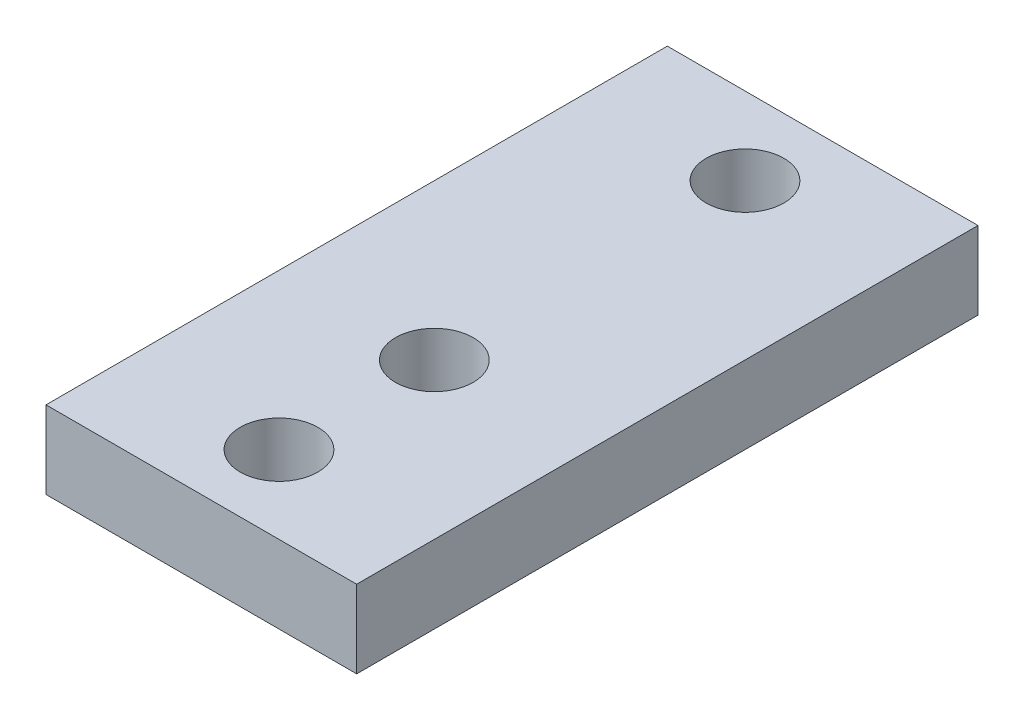
from build123d import *

# Parameters (mm, degrees)
SKETCH1_W           = 25.4
SKETCH1_H           = 50.8
SKETCH1_R           = 3.175
BOSS_EXTRUDE1_DEPTH = 6.35


with BuildPart() as part:
    # Sketch1 → Boss-Extrude1 (new body)
    with BuildSketch(Plane(origin=(0, 0, 0), x_dir=(1, 0, 0), z_dir=(0, 1, 0))):
        Rectangle(SKETCH1_W, SKETCH1_H)
        with Locations((0, -19.05)):
            Circle(SKETCH1_R, mode=Mode.SUBTRACT)
        with Locations((0, -6.35)):
            Circle(SKETCH1_R, mode=Mode.SUBTRACT)
        with Locations((0, 19.05)):
            Circle(SKETCH1_R, mode=Mode.SUBTRACT)
    extrude(amount=BOSS_EXTRUDE1_DEPTH)


solid = part.part
